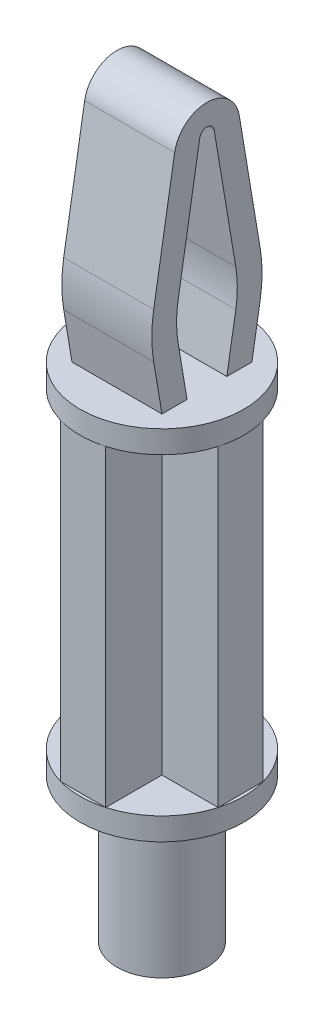
from build123d import *

# Parameters (mm, degrees)
BOSS_EXTRUDE1_DEPTH = 6.95
SKETCH2_R           = 3.640054945
BOSS_EXTRUDE2_DEPTH = 1
SKETCH3_R           = 2
BOSS_EXTRUDE4_DEPTH = 6.4
BOSS_EXTRUDE5_DEPTH = 2


with BuildPart() as part:
    # Sketch1 → Boss-Extrude1 (new, symmetric)
    with BuildSketch(Plane(origin=(0, 0, 0), x_dir=(1, 0, 0), z_dir=(0, 1, 0))):
        Polygon((-1, -3.5), (1, -3.5), (1, -1), (3.5, -1), (3.5, 1), (1, 1), (1, 3.5), (-1, 3.5), (-1, 1), (-3.5, 1), (-3.5, -1), (-1, -1), align=None)
    extrude(amount=BOSS_EXTRUDE1_DEPTH, both=True)

    # Sketch2 → Boss-Extrude2 (add)
    with BuildSketch(Plane(origin=(0, 6.95, 0), x_dir=(1, 0, 0), z_dir=(0, 1, 0))):
        with Locations(Location((0, 0, 0), (0, 0, 74.054604099))):
            Circle(SKETCH2_R)
    boss_extrude2 = extrude(amount=BOSS_EXTRUDE2_DEPTH)

    # Mirror1: Boss-Extrude2 across plane
    add(boss_extrude2.mirror(Plane.ZX))

    # Sketch3 → Boss-Extrude4 (add)
    with BuildSketch(Plane(origin=(0, -7.95, 0), x_dir=(1, 0, 0), z_dir=(0, 1, 0))):
        with Locations(Location((0, 0, 0), (0, 0, 270))):
            Circle(SKETCH3_R)
    extrude(amount=-BOSS_EXTRUDE4_DEPTH)

    # Sketch6 → Boss-Extrude5 (add, symmetric)
    with BuildSketch(Plane(origin=(0, 0, 0), x_dir=(0, 0, -1), z_dir=(1, 0, 0))):
        with BuildLine():
            Line((-2, 7.95), (-2.366643319, 10.14501086))
            ThreePointArc((-2.366643319, 10.14501086), (-2.45, 11.15), (-2.366643319, 12.15498914))
            Line((-2.366643319, 12.15498914), (-1.435716028, 17.728240876))
            ThreePointArc((-1.435716028, 17.728240876), (0, 18.944033198), (1.435716028, 17.728240876))
            Line((1.435716028, 17.728240876), (2.366643319, 12.15498914))
            ThreePointArc((2.366643319, 12.15498914), (2.45, 11.15), (2.366643319, 10.14501086))
            Line((2.366643319, 10.14501086), (2, 7.95))
            Line((2, 7.95), (0.884760215, 7.95))
            Line((0.884760215, 7.95), (1.281674852, 10.32623841))
            ThreePointArc((1.281674852, 10.32623841), (1.35, 11.15), (1.281674852, 11.97376159))
            Line((1.281674852, 11.97376159), (0.320476243, 17.728240876))
            ThreePointArc((0.320476243, 17.728240876), (0, 17.999626406), (-0.320476243, 17.728240876))
            Line((-0.320476243, 17.728240876), (-1.281674852, 11.97376159))
            ThreePointArc((-1.281674852, 11.97376159), (-1.35, 11.15), (-1.281674852, 10.32623841))
            Line((-1.281674852, 10.32623841), (-0.884760215, 7.95))
            Line((-0.884760215, 7.95), (-2, 7.95))
        make_face()
    extrude(amount=BOSS_EXTRUDE5_DEPTH, both=True)


solid = part.part
